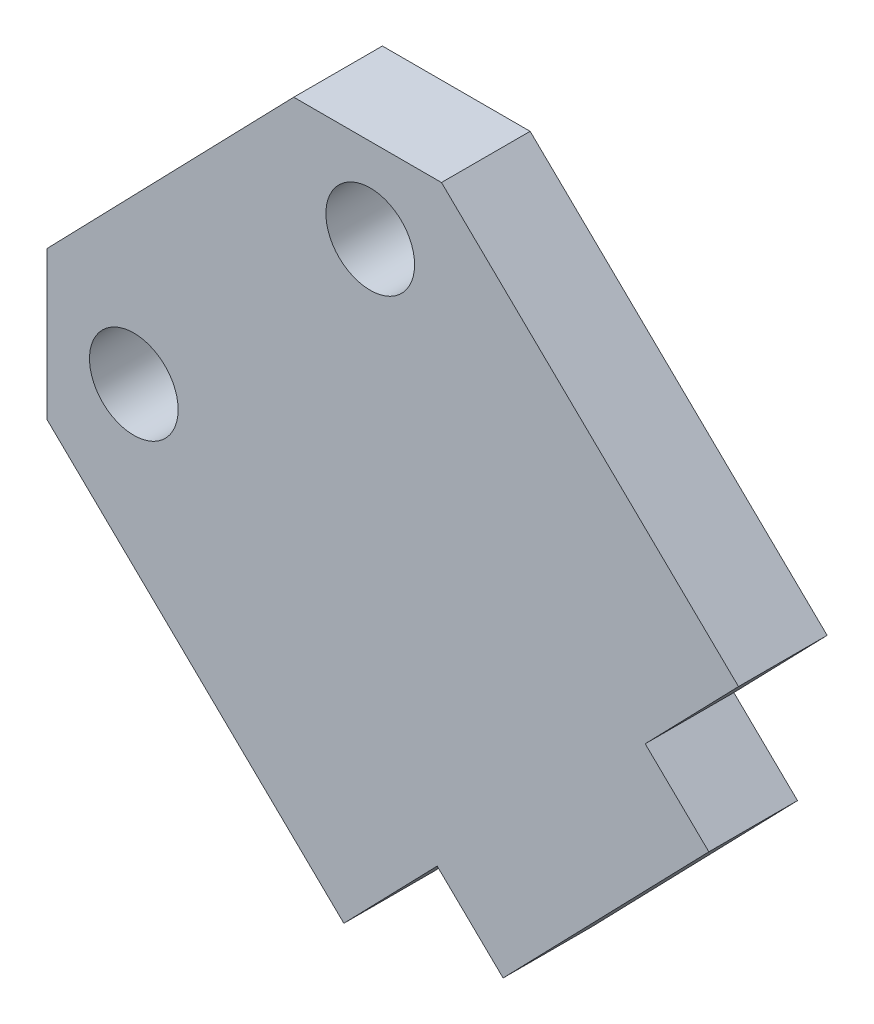
from build123d import *

# Parameters (mm, degrees)
ESQUISSE1_R        = 1.5
BOSS_EXTRU_2_DEPTH = 3


with BuildPart() as part:
    # Esquisse1 → Boss.-Extru.2 (new body)
    with BuildSketch(Plane.XY):
        Polygon((-10.943102451, -5.75), (-2.589352418, 2.864804721), (2.410647582, 2.864804721), (12.46125309, -6.881236984), (9.304151267, -10.136998238), (11.457852448, -12.225435747), (4.496394087, -19.404439681), (2.26460488, -17.24028045), (-0.892496943, -20.496041705), (-10.943102451, -10.75), align=None)
        Circle(ESQUISSE1_R, mode=Mode.SUBTRACT)
        with Locations((-8, -8.25)):
            Circle(ESQUISSE1_R, mode=Mode.SUBTRACT)
    extrude(amount=BOSS_EXTRU_2_DEPTH)


solid = part.part
